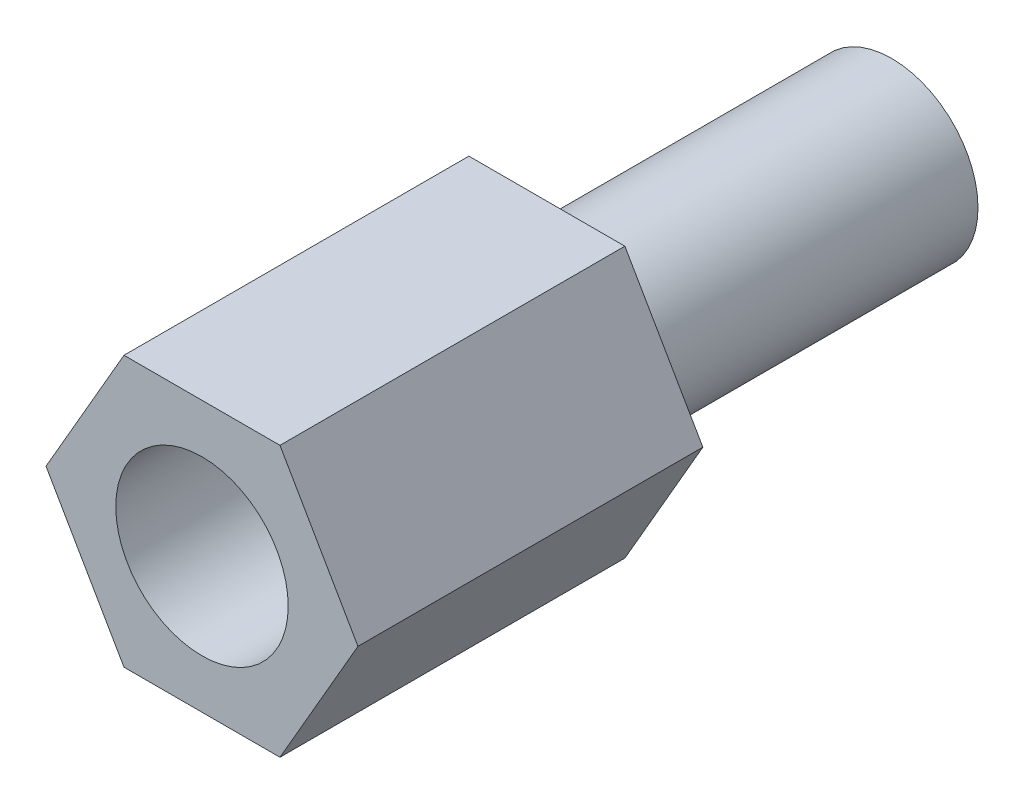
from build123d import *

# Parameters (mm, degrees)
EXTRUDE_1_DEPTH     = 6
SKETCH_2_R          = 1.5
CUT_EXTRUDE_1_DEPTH = 3
SKETCH_3_R          = 1.5
EXTRUDE_2_DEPTH     = 6


with BuildPart() as part:
    # 草图1 → 凸台-拉伸1 (new body)
    with BuildSketch(Plane.XY):
        Polygon((2.713546265, 0), (1.356773133, 2.35), (-1.356773133, 2.35), (-2.713546265, 0), (-1.356773133, -2.35), (1.356773133, -2.35), align=None)
    extrude(amount=-EXTRUDE_1_DEPTH)

    # 草图2 → 切除-拉伸1 (cut)
    with BuildSketch(Plane.XY):
        Circle(SKETCH_2_R)
    extrude(amount=-CUT_EXTRUDE_1_DEPTH, mode=Mode.SUBTRACT)

    # 草图3 → 凸台-拉伸2 (add)
    with BuildSketch(Plane(origin=(0, 0, -6), x_dir=(-1, 0, 0), z_dir=(0, 0, -1))):
        with Locations(Location((0, 0, 0), (0, 0, 180))):
            Circle(SKETCH_3_R)
    extrude(amount=EXTRUDE_2_DEPTH)


solid = part.part
